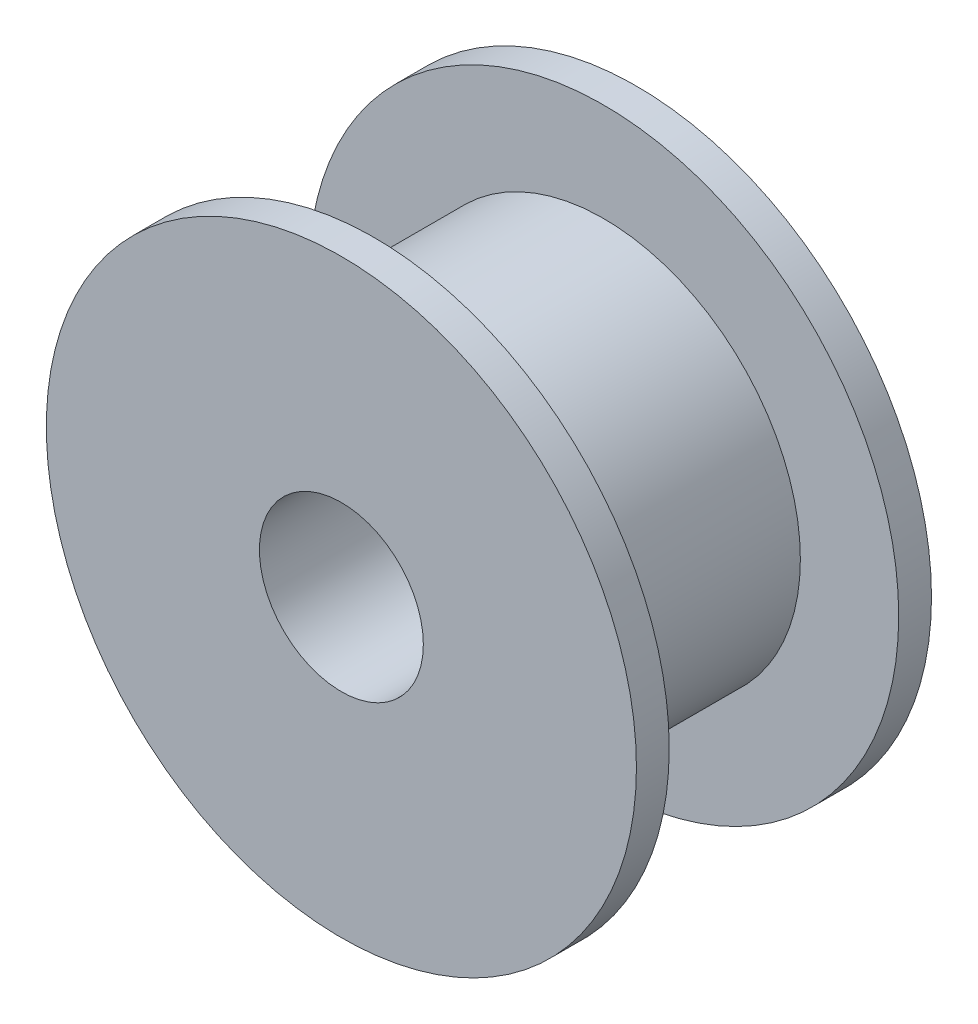
from build123d import *

# Parameters (mm, degrees)
SKETCH1_R           = 9
BOSS_EXTRUDE1_DEPTH = 1
SKETCH2_R           = 6
BOSS_EXTRUDE2_DEPTH = 7
SKETCH3_R           = 9
BOSS_EXTRUDE3_DEPTH = 1
SKETCH4_R           = 2.5
CUT_EXTRUDE1_DEPTH  = 16.588457268


with BuildPart() as part:
    # Sketch1 → Boss-Extrude1 (new body)
    with BuildSketch(Plane.XY):
        Circle(SKETCH1_R)
    extrude(amount=BOSS_EXTRUDE1_DEPTH)

    # Sketch2 → Boss-Extrude2 (add)
    with BuildSketch(Plane.XY.offset(1)):
        Circle(SKETCH2_R)
    extrude(amount=BOSS_EXTRUDE2_DEPTH)

    # Sketch3 → Boss-Extrude3 (add)
    with BuildSketch(Plane.XY.offset(8)):
        Circle(SKETCH3_R)
    extrude(amount=BOSS_EXTRUDE3_DEPTH)

    # Sketch4 → Cut-Extrude1 (cut, through all)
    with BuildSketch(Plane.XY.offset(9)):
        Circle(SKETCH4_R)
    extrude(amount=-CUT_EXTRUDE1_DEPTH, mode=Mode.SUBTRACT)


solid = part.part
